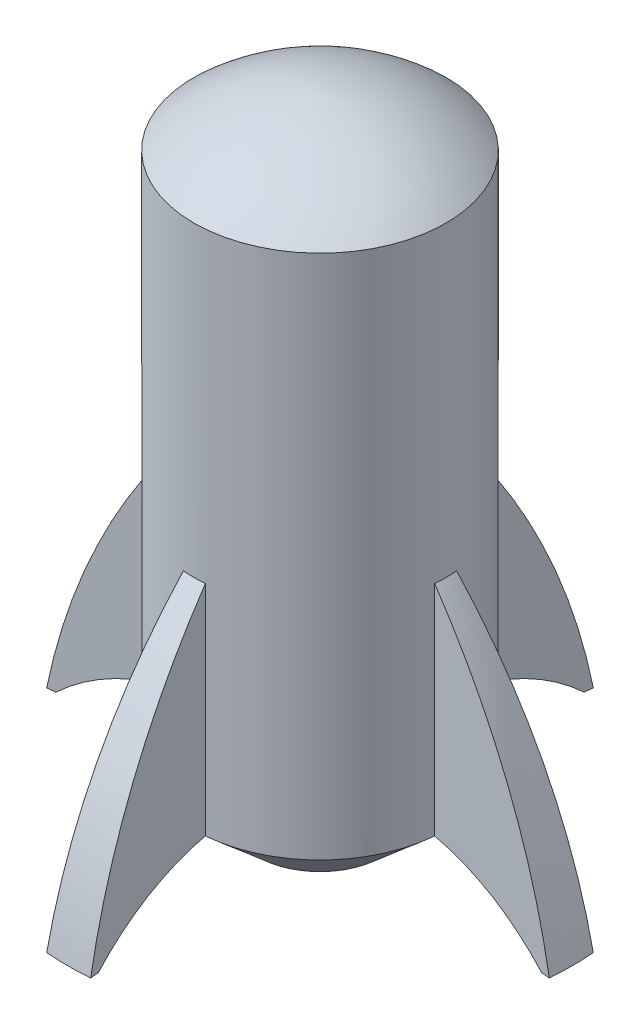
from build123d import *

# Parameters (mm, degrees)
REVOLVE2_ANGLE    = 10
CIRPATTERN1_COUNT = 4


with BuildPart() as part:
    # Sketch1 → Revolve1 (revolve)
    with BuildSketch(Plane(origin=(0, 0, 0), x_dir=(0, 0, -1), z_dir=(1, 0, 0))):
        with BuildLine():
            Line((0, 0), (15, 0))
            Line((15, 0), (30, 13))
            Line((30, 13), (30, 138))
            ThreePointArc((30, 138), (15.99604281, 146.490107024), (0, 150))
            Line((0, 150), (0, 147.997234749))
            ThreePointArc((0, 147.997234749), (14.877376235, 144.781675111), (28, 137.069808089))
            Line((28, 137.069808089), (28, 13.913257766))
            Line((28, 13.913257766), (14.253933347, 2))
            Line((14.253933347, 2), (0, 2))
            Line((0, 2), (0, 0))
        make_face()
    revolve(axis=Axis((0, 0, 0), (0, 1, 0)))

    # Sketch2 → Revolve2 (revolve, symmetric)
    with BuildSketch(Plane(origin=(0, 0, 0), x_dir=(0, 0, -1), z_dir=(1, 0, 0))) as revolve2_sk:
        with BuildLine():
            Line((30, 65), (30, 13))
            ThreePointArc((30, 13), (45.028412977, 8.715043336), (58, 0))
            Line((58, 0), (60, 0))
            ThreePointArc((60, 0), (48.934577237, 34.315958725), (30, 65))
        make_face()
    revolve2 = revolve(axis=Axis((0, 0, 0), (0, 1, 0)), revolution_arc=REVOLVE2_ANGLE / 2)
    revolve2 = revolve2 + revolve(revolve2_sk.sketch, axis=Axis((0, 0, 0), (0, -1, 0)), revolution_arc=REVOLVE2_ANGLE / 2)

    # CirPattern1: Revolve2 ×4 about axis
    cirpattern1_axis = Axis((0, 0, 0), (0, -1, 0))
    for i in range(1, CIRPATTERN1_COUNT):
        add(revolve2.rotate(cirpattern1_axis, i * 360 / CIRPATTERN1_COUNT))


solid = part.part
